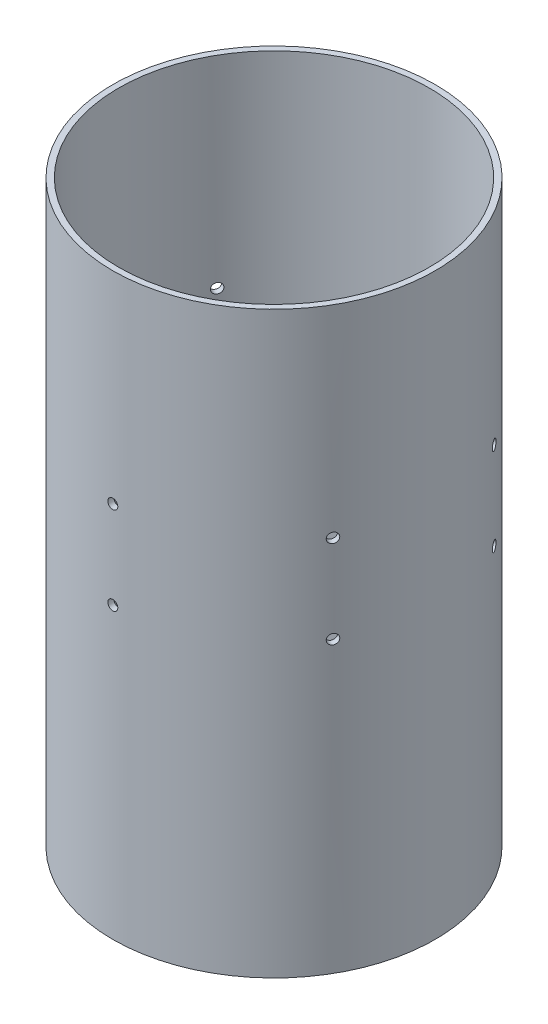
from build123d import *

# Parameters (mm, degrees)
SKETCH1_R           = 49.5046
SKETCH1_R_2         = 47.6885
BOSS_EXTRUDE1_DEPTH = 177.8
SKETCH2_R           = 1.524
CUT_EXTRUDE1_DEPTH  = 177.8
CIRPATTERN1_COUNT   = 6
SKETCH3_R           = 1.524
CUT_EXTRUDE2_DEPTH  = 177.8
CIRPATTERN2_COUNT   = 6


with BuildPart() as part:
    # Sketch1 → Boss-Extrude1 (new body)
    with BuildSketch(Plane(origin=(0, 0, 0), x_dir=(1, 0, 0), z_dir=(0, 1, 0))):
        with Locations(Location((0, 0, 0), (0, 0, 270))):
            Circle(SKETCH1_R)
        with Locations(Location((0, 0, 0), (0, 0, 270))):
            Circle(SKETCH1_R_2, mode=Mode.SUBTRACT)
    extrude(amount=BOSS_EXTRUDE1_DEPTH)

    # Sketch2 → Cut-Extrude1 (cut)
    with BuildSketch(Plane.XY):
        with Locations(Location((0, 115.824, 0), (0, 0, 90))):
            Circle(SKETCH2_R)
    cut_extrude1 = extrude(amount=-CUT_EXTRUDE1_DEPTH, mode=Mode.SUBTRACT)

    # CirPattern1: Cut-Extrude1 ×6 about axis
    cirpattern1_axis = Axis((0, 177.8, 0), (0, -1, 0))
    for i in range(1, CIRPATTERN1_COUNT):
        add(cut_extrude1.rotate(cirpattern1_axis, i * 360 / CIRPATTERN1_COUNT), mode=Mode.SUBTRACT)

    # Sketch3 → Cut-Extrude2 (cut)
    with BuildSketch(Plane.XY):
        with Locations(Location((0, 88.9, 0), (0, 0, 90))):
            Circle(SKETCH3_R)
    cut_extrude2 = extrude(amount=-CUT_EXTRUDE2_DEPTH, mode=Mode.SUBTRACT)

    # CirPattern2: Cut-Extrude2 ×6 about axis
    cirpattern2_axis = Axis((0, 177.8, 0), (0, -1, 0))
    for i in range(1, CIRPATTERN2_COUNT):
        add(cut_extrude2.rotate(cirpattern2_axis, i * 360 / CIRPATTERN2_COUNT), mode=Mode.SUBTRACT)


solid = part.part
